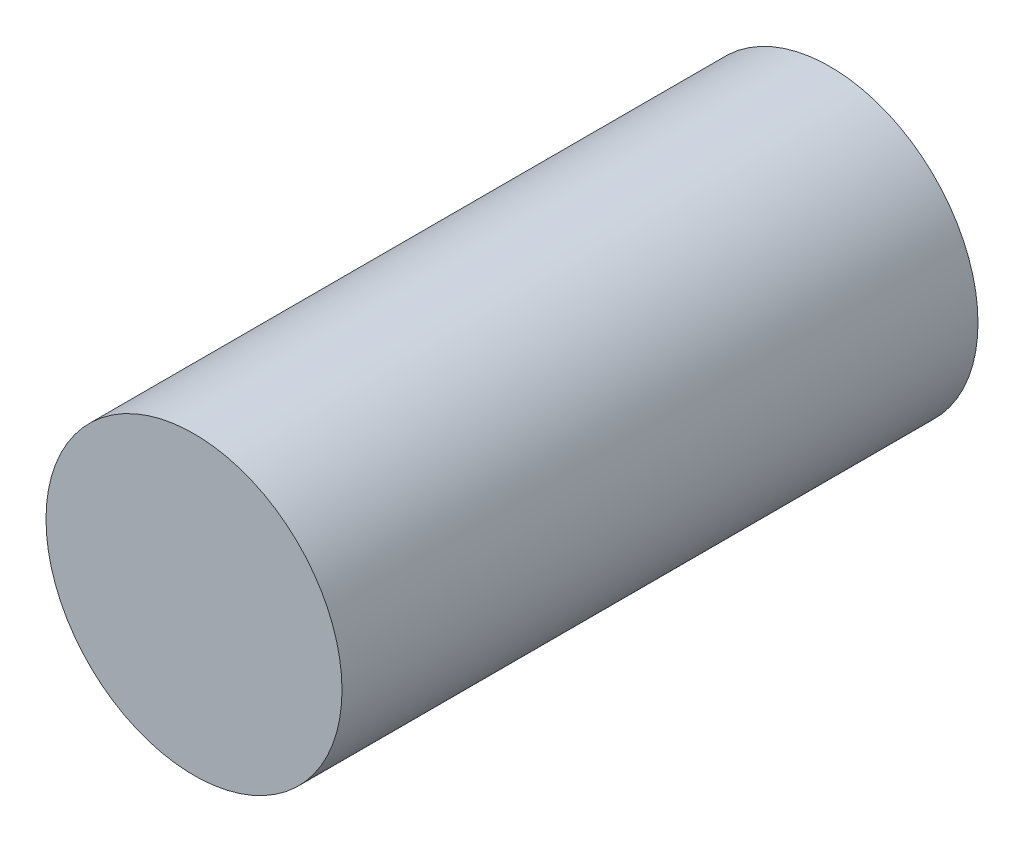
from build123d import *

# Parameters (mm, degrees)
SKETCH1_R           = 3.7
BOSS_EXTRUDE1_DEPTH = 15.9


with BuildPart() as part:
    # Sketch1 → Boss-Extrude1 (new body)
    with BuildSketch(Plane.XY):
        Circle(SKETCH1_R)
    extrude(amount=BOSS_EXTRUDE1_DEPTH)


solid = part.part
